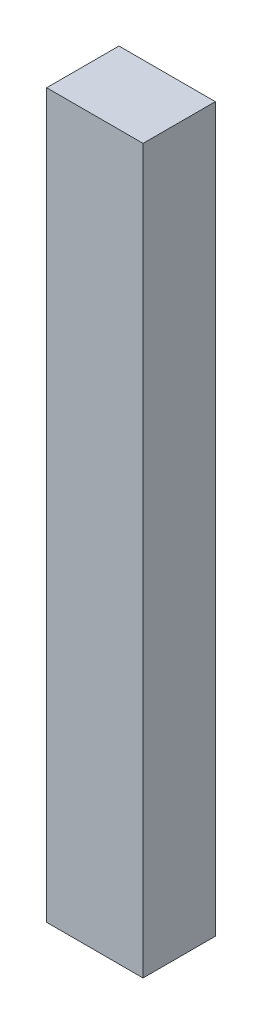
from build123d import *

# Parameters (mm, degrees)
SKETCH1_W           = 8
SKETCH1_H           = 6
BOSS_EXTRUDE1_DEPTH = 30


with BuildPart() as part:
    # Sketch1 → Boss-Extrude1 (new, symmetric)
    with BuildSketch(Plane(origin=(0, 0, 0), x_dir=(-1, 0, 0), z_dir=(0, 1, 0))):
        Rectangle(SKETCH1_W, SKETCH1_H)
    extrude(amount=BOSS_EXTRUDE1_DEPTH, both=True)


solid = part.part
